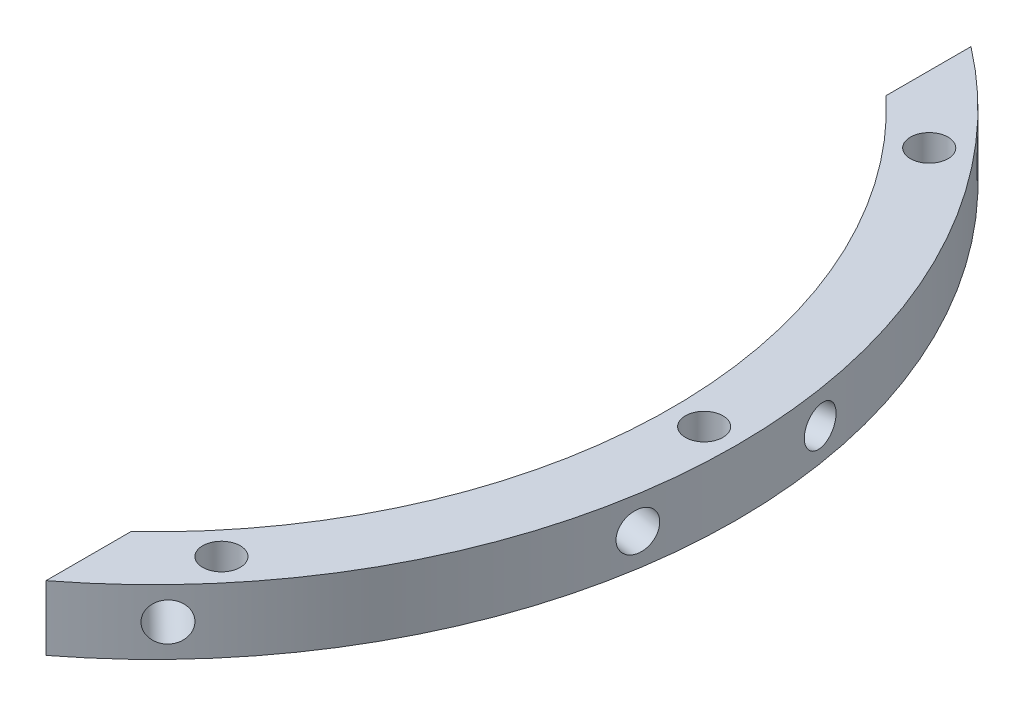
from build123d import *

# Parameters (mm, degrees)
EXTRUDE_1_DEPTH          = 5
SKETCH_2_R               = 1.45
CUT_EXTRUDE_1_DEPTH      = 5
SKETCH_3_R               = 1.475
CUT_EXTRUDE_2_DEPTH      = 46
PATTERN_CIRCULAR_1_COUNT = 2
PATTERN_CIRCULAR_1_ANGLE = 35
MIRROR_1_COPY_1_SKETCH_R = 1.475
MIRROR_1_COPY_1_DEPTH    = 46


with BuildPart() as part:
    # Эскиз1 → Бобышка-Вытянуть1 (new body)
    with BuildSketch(Plane(origin=(0, 0, 0), x_dir=(1, 0, 0), z_dir=(0, 1, 0))):
        with BuildLine():
            Line((27.395437576, 29.146011734), (27.395437576, 35.7))
            ThreePointArc((27.395437576, 35.7), (45, 0), (27.395437576, -35.7))
            Line((27.395437576, -35.7), (27.395437576, -29.146011734))
            ThreePointArc((27.395437576, -29.146011734), (40, 0), (27.395437576, 29.146011734))
        make_face()
    extrude(amount=EXTRUDE_1_DEPTH)

    # Эскиз2 → Вырез-Вытянуть1 (cut)
    with BuildSketch(Plane(origin=(0, 5, 0), x_dir=(1, 0, 0), z_dir=(0, 1, 0))):
        with Locations((42.5, 0)):
            Circle(SKETCH_2_R)
        with Locations((32.556888833, 27.318473412)):
            Circle(SKETCH_2_R)
        with Locations((32.556888833, -27.318473412)):
            Circle(SKETCH_2_R)
    extrude(amount=-CUT_EXTRUDE_1_DEPTH, mode=Mode.SUBTRACT)

    # Эскиз3 → Вырез-Вытянуть2 (cut)
    with BuildSketch(Plane(origin=(0, 0, 0), x_dir=(0, 1, 0), z_dir=(0.7193398003386524, 0, 0.6946583704589961))):
        with Locations((2.5, 0)):
            Circle(SKETCH_3_R)
    cut_extrude_2 = extrude(amount=CUT_EXTRUDE_2_DEPTH, mode=Mode.SUBTRACT)

    # Круговой массив1: Вырез-Вытянуть2 ×2 about axis
    pattern_circular_1_axis = Axis((0, -0.25, 0), (0, 1, 0))
    for i in range(1, PATTERN_CIRCULAR_1_COUNT):
        add(cut_extrude_2.rotate(pattern_circular_1_axis, i * PATTERN_CIRCULAR_1_ANGLE / (PATTERN_CIRCULAR_1_COUNT - 1)), mode=Mode.SUBTRACT)

    # Зеркальное отражение1: Вырез-Вытянуть2 across plane
    add(cut_extrude_2.mirror(Plane.XY), mode=Mode.SUBTRACT)

    # Зеркальное отражение1 copy 1 sketch → Зеркальное отражение1 copy 1 (cut)
    with BuildSketch(Plane(origin=(0, 0, 0), x_dir=(0, 1, 0), z_dir=(0.9876883405951382, 0, -0.15643446504022812))):
        with Locations((2.5, 0)):
            Circle(MIRROR_1_COPY_1_SKETCH_R)
    extrude(amount=MIRROR_1_COPY_1_DEPTH, mode=Mode.SUBTRACT)


solid = part.part
